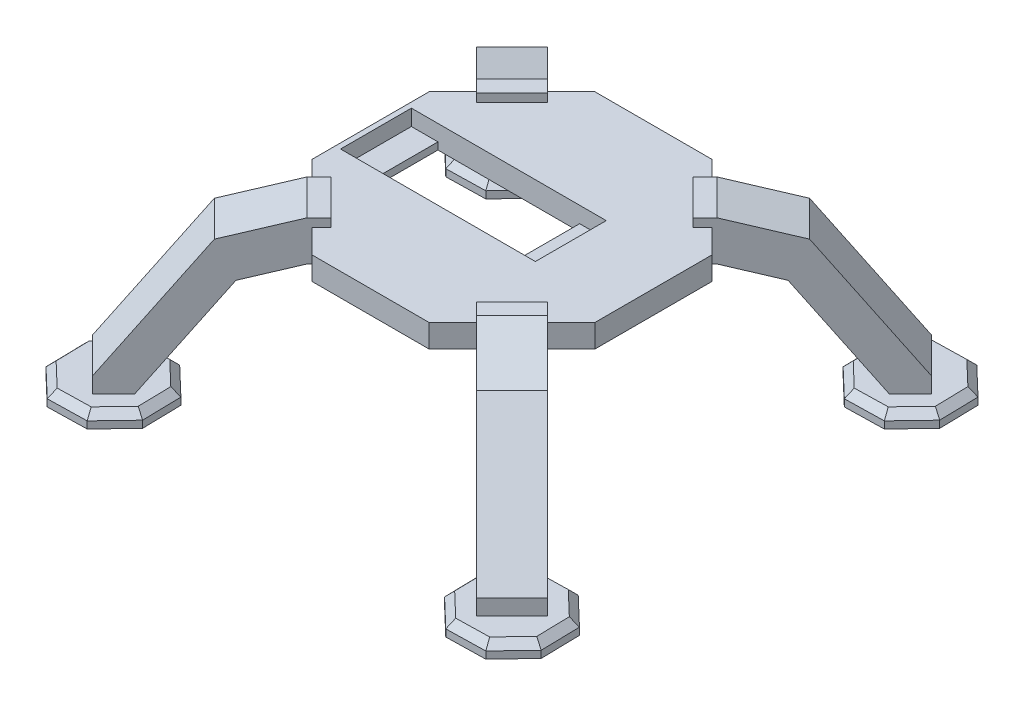
from build123d import *

# Parameters (mm, degrees)
SKETCH1_W           = 40
SKETCH1_H           = 20
BOSS_EXTRUDE1_DEPTH = 6.5
CUT_EXTRUDE1_REACH  = 60.8
CUT_EXTRUDE1_START  = 2
SKETCH1_3_W         = 7.5
SKETCH1_3_H         = 20
BOSS_EXTRUDE2_DEPTH = 7.07
BOSS_EXTRUDE4_DEPTH = 4
CHAMFER3_SIZE       = 2
CIRPATTERN7_COUNT   = 4


with BuildPart() as part:
    # Sketch1 → Boss-Extrude1 (new body)
    with BuildSketch(Plane(origin=(0, 0, 0), x_dir=(1, 0, 0), z_dir=(0, 1, 0))):
        Polygon((16.527121139, -39.9), (39.9, -16.527121139), (39.9, 16.527121139), (16.527121139, 39.9), (-16.527121139, 39.9), (-39.9, 16.527121139), (-39.9, -16.527121139), (-16.527121139, -39.9), align=None)
        with Locations((-10.9, 0)):
            Rectangle(SKETCH1_W, SKETCH1_H, mode=Mode.SUBTRACT)
    extrude(amount=BOSS_EXTRUDE1_DEPTH)

    # Sketch1<3> → Cut-Extrude1 (cut, up to next)
    with BuildSketch(Plane(origin=(0, 0, 0), x_dir=(1, 0, 0), z_dir=(0, 1, 0)).offset(CUT_EXTRUDE1_START), mode=Mode.PRIVATE) as cut_extrude1_sk1:
        with Locations((12.85, 0)):
            Rectangle(SKETCH1_3_W, SKETCH1_3_H)
    cut_extrude1_tool1 = extrude(cut_extrude1_sk1.sketch, amount=CUT_EXTRUDE1_REACH, mode=Mode.PRIVATE) & part.part
    # Sketch1<3> → Cut-Extrude1 (cut, up to next)
    with BuildSketch(Plane(origin=(0, 0, 0), x_dir=(1, 0, 0), z_dir=(0, 1, 0)).offset(CUT_EXTRUDE1_START), mode=Mode.PRIVATE) as cut_extrude1_sk2:
        with Locations((-34.65, 0)):
            Rectangle(SKETCH1_3_W, SKETCH1_3_H)
    cut_extrude1_tool2 = extrude(cut_extrude1_sk2.sketch, amount=CUT_EXTRUDE1_REACH, mode=Mode.PRIVATE) & part.part
    add(cut_extrude1_tool1.solids().sort_by_distance((12.85, 2, 0))[0], mode=Mode.SUBTRACT)
    add(cut_extrude1_tool2.solids().sort_by_distance((-34.65, 2, 0))[0], mode=Mode.SUBTRACT)


with BuildPart() as body_2:
    # Sketch2 → Boss-Extrude2 (new, symmetric)
    with BuildSketch(Plane(origin=(0, 0, 0), x_dir=(0.7071067811865471, 0, -0.707106781186548), z_dir=(0.707106781186548, 0, 0.7071067811865471))):
        Polygon((-39.9, 6.5), (-39.9, 0), (-36.140077619, 0), (-36.140077619, -2.391913707), (-40.880861767, -2.391913707), (-55.102173788, -6.399620024), (-75.352322851, -34.234042407), (-83.743832643, -34.234042407), (-83.743832643, -29.780280207), (-59.407314373, 3.670976213), (-40.880861767, 8.891913707), (-36.140077619, 8.891913707), (-36.140077619, 6.5), align=None)
    extrude(amount=BOSS_EXTRUDE2_DEPTH, both=True)


with BuildPart() as body_3:
    # Sketch8 → Boss-Extrude4 (new body)
    with BuildSketch(Plane(origin=(-16.213958493, -34.234042407, -16.213958493), x_dir=(0.7071067811865475, 0, -0.7071067811865477), z_dir=(0, 1, 0))):
        Polygon((-74.316456022, -9.468530462), (-85.367458944, -9.711988406), (-93.009547285, -17.698378275), (-92.766089341, -28.749381197), (-84.779699472, -36.391469538), (-73.72869655, -36.148011594), (-66.086608209, -28.161621725), (-66.330066153, -17.110618803), align=None)
    extrude(amount=-BOSS_EXTRUDE4_DEPTH)

    # Chamfer3
    chamfer3_edges = [body_3.edges().sort_by_distance(p)[0] for p in [
        (-47.024168546, -34.234042407, 46.608559838),
        (-42.909244639, -34.234042407, 55.955105469),
        (-46.608559838, -34.234042407, 65.473801865),
        (-55.955105469, -34.234042407, 69.588725771),
        (-65.473801865, -34.234042407, 65.889410573),
        (-69.588725771, -34.234042407, 56.542864941),
        (-65.889410573, -34.234042407, 47.024168546),
        (-56.542864941, -34.234042407, 42.909244639),
    ]]
    chamfer(chamfer3_edges, length=CHAMFER3_SIZE)


with BuildPart() as cirpattern7_1:
    # CirPattern7: pattern copy
    add(body_2.part.rotate(Axis((0, 0, 0), (0, 1, 0)), 1 * 360 / CIRPATTERN7_COUNT))


with BuildPart() as cirpattern7_2:
    # CirPattern7: pattern copy
    add(body_2.part.rotate(Axis((0, 0, 0), (0, 1, 0)), 2 * 360 / CIRPATTERN7_COUNT))


with BuildPart() as cirpattern7_3:
    # CirPattern7: pattern copy
    add(body_2.part.rotate(Axis((0, 0, 0), (0, 1, 0)), 3 * 360 / CIRPATTERN7_COUNT))


with BuildPart() as cirpattern7_4:
    # CirPattern7: pattern copy
    add(body_3.part.rotate(Axis((0, 0, 0), (0, 1, 0)), 1 * 360 / CIRPATTERN7_COUNT))


with BuildPart() as cirpattern7_5:
    # CirPattern7: pattern copy
    add(body_3.part.rotate(Axis((0, 0, 0), (0, 1, 0)), 2 * 360 / CIRPATTERN7_COUNT))


with BuildPart() as cirpattern7_6:
    # CirPattern7: pattern copy
    add(body_3.part.rotate(Axis((0, 0, 0), (0, 1, 0)), 3 * 360 / CIRPATTERN7_COUNT))


solid = Compound([part.part, body_2.part, body_3.part, cirpattern7_1.part, cirpattern7_2.part, cirpattern7_3.part, cirpattern7_4.part, cirpattern7_5.part, cirpattern7_6.part])
